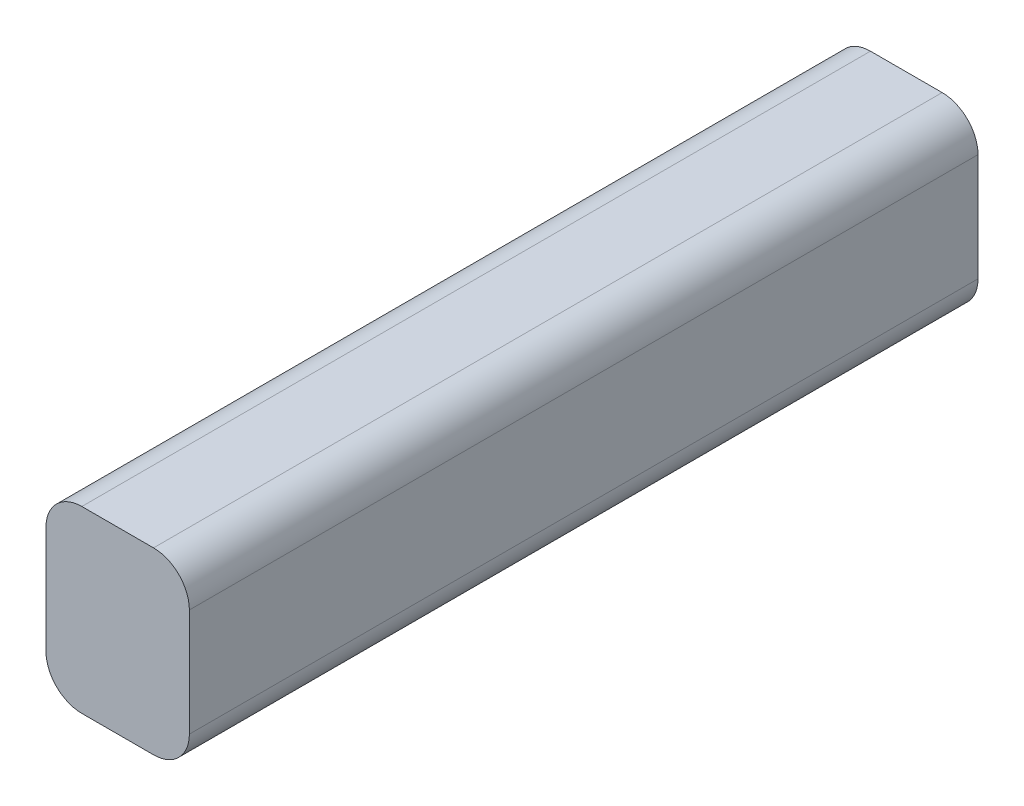
from build123d import *

# Parameters (mm, degrees)
SKETCH1_W           = 200
SKETCH1_H           = 250
BOSS_EXTRUDE1_DEPTH = 1100
FILLET1_R           = 50
FILLET2_R           = 50
FILLET3_R           = 50
FILLET4_R           = 50


with BuildPart() as part:
    # Sketch1 → Boss-Extrude1 (new body)
    with BuildSketch(Plane.XY):
        Rectangle(SKETCH1_W, SKETCH1_H)
    extrude(amount=BOSS_EXTRUDE1_DEPTH)

    # Fillet1
    fillet1_edges = [part.edges().sort_by_distance(p)[0] for p in [
        (-100, 125, 550),
    ]]
    fillet(fillet1_edges, radius=FILLET1_R)

    # Fillet2
    fillet2_edges = [part.edges().sort_by_distance(p)[0] for p in [
        (-100, -125, 550),
    ]]
    fillet(fillet2_edges, radius=FILLET2_R)

    # Fillet3
    fillet3_edges = [part.edges().sort_by_distance(p)[0] for p in [
        (100, 125, 550),
    ]]
    fillet(fillet3_edges, radius=FILLET3_R)

    # Fillet4
    fillet4_edges = [part.edges().sort_by_distance(p)[0] for p in [
        (100, -125, 550),
    ]]
    fillet(fillet4_edges, radius=FILLET4_R)


solid = part.part
